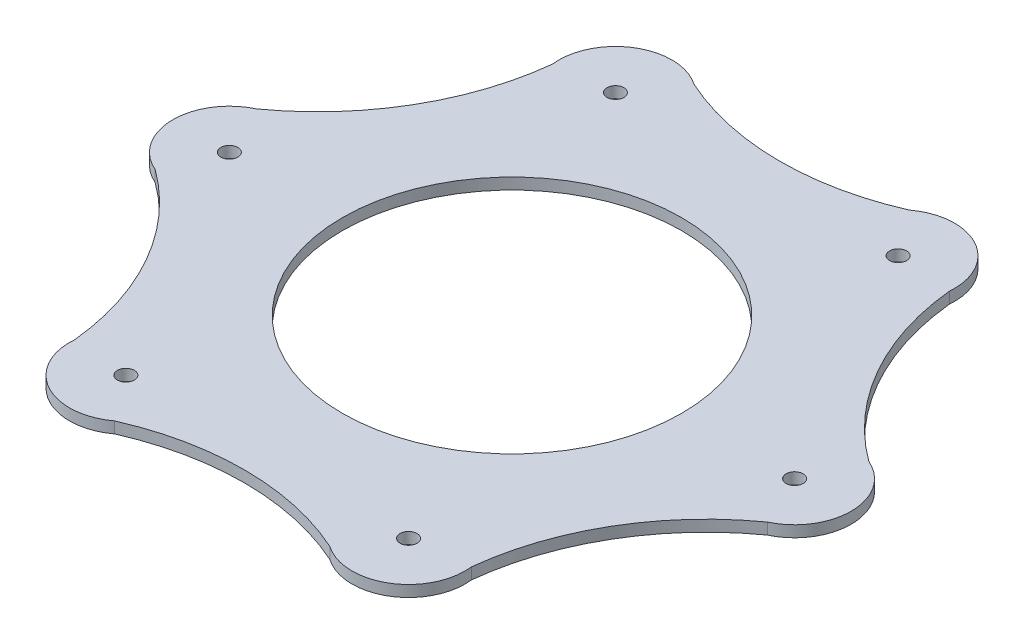
from build123d import *

# Parameters (mm, degrees)
SKETCH1_R           = 30
SKETCH1_R_2         = 1.5
BOSS_EXTRUDE1_DEPTH = 2


with BuildPart() as part:
    # Sketch1 → Boss-Extrude1 (new body)
    with BuildSketch(Plane(origin=(0, 0, 0), x_dir=(1, 0, 0), z_dir=(0, 1, 0))):
        with BuildLine():
            ThreePointArc((-34.962941109, -42.441151321), (-29.8558191, -52.043181929), (-19.005152341, -51.305131854))
            ThreePointArc((-19.005152341, -51.305131854), (0.154978651, -47.316486178), (19.273644656, -51.499370852))
            ThreePointArc((19.273644656, -51.499370852), (30.142808095, -51.877488756), (34.928971359, -42.111510658))
            ThreePointArc((34.928971359, -42.111510658), (41.054768373, -23.52402764), (54.236585765, -9.05821953))
            ThreePointArc((54.236585765, -9.05821953), (59.998627194, 0.165693174), (53.934123701, 9.193621197))
            ThreePointArc((53.934123701, 9.193621197), (40.899789722, 23.792458538), (34.962941109, 42.441151321))
            ThreePointArc((34.962941109, 42.441151321), (29.8558191, 52.043181929), (19.005152341, 51.305131854))
            ThreePointArc((19.005152341, 51.305131854), (-0.154978651, 47.316486178), (-19.273644656, 51.499370852))
            ThreePointArc((-19.273644656, 51.499370852), (-30.142808095, 51.877488756), (-34.928971359, 42.111510658))
            ThreePointArc((-34.928971359, 42.111510658), (-41.054768373, 23.52402764), (-54.236585765, 9.05821953))
            ThreePointArc((-54.236585765, 9.05821953), (-59.998627194, -0.165693174), (-53.934123701, -9.193621197))
            ThreePointArc((-53.934123701, -9.193621197), (-40.899789722, -23.792458538), (-34.962941109, -42.441151321))
        make_face()
        with Locations(Location((0, 0, 0), (0, 0, 90))):
            Circle(SKETCH1_R, mode=Mode.SUBTRACT)
        with Locations(Location((50, 0, 0), (0, 0, 90))):
            Circle(SKETCH1_R_2, mode=Mode.SUBTRACT)
        with Locations(Location((25, -43.301270189, 0), (0, 0, 90))):
            Circle(SKETCH1_R_2, mode=Mode.SUBTRACT)
        with Locations(Location((25, 43.301270189, 0), (0, 0, 90))):
            Circle(SKETCH1_R_2, mode=Mode.SUBTRACT)
        with Locations(Location((-25, -43.301270189, 0), (0, 0, 90))):
            Circle(SKETCH1_R_2, mode=Mode.SUBTRACT)
        with Locations(Location((-50, 0, 0), (0, 0, 90))):
            Circle(SKETCH1_R_2, mode=Mode.SUBTRACT)
        with Locations(Location((-25, 43.301270189, 0), (0, 0, 90))):
            Circle(SKETCH1_R_2, mode=Mode.SUBTRACT)
    extrude(amount=-BOSS_EXTRUDE1_DEPTH)


solid = part.part
